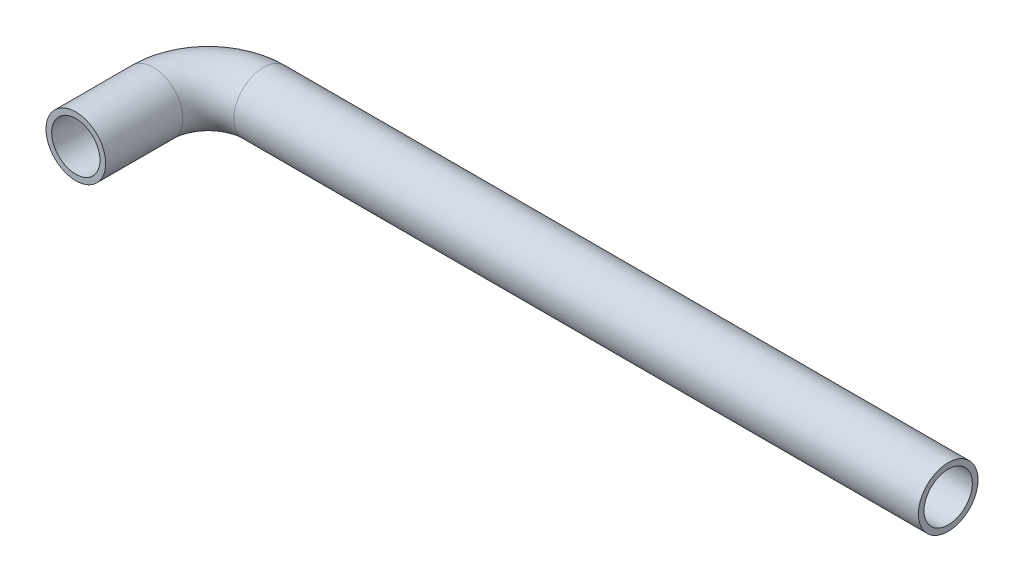
from build123d import *

# Parameters (mm, degrees)
SKETCH2_R   = 6.858
SKETCH2_R_2 = 5.55625


with BuildPart() as part:
    # Sweep5: sweep along a path in Sketch6
    with BuildLine(Plane(origin=(0, 0, 0), x_dir=(1, 0, 0), z_dir=(0, 1, 0))) as sweep5_path:
        Line((0, 0), (0, 17.78))
        ThreePointArc((0, 17.78), (3.719743879, 26.760256121), (12.7, 30.48))
        Line((12.7, 30.48), (170.18, 30.48))
    # Sketch2 → Sweep5 (sweep)
    with BuildSketch(Plane.XY):
        Circle(SKETCH2_R)
        Circle(SKETCH2_R_2, mode=Mode.SUBTRACT)
    sweep(path=sweep5_path.line)


solid = part.part
